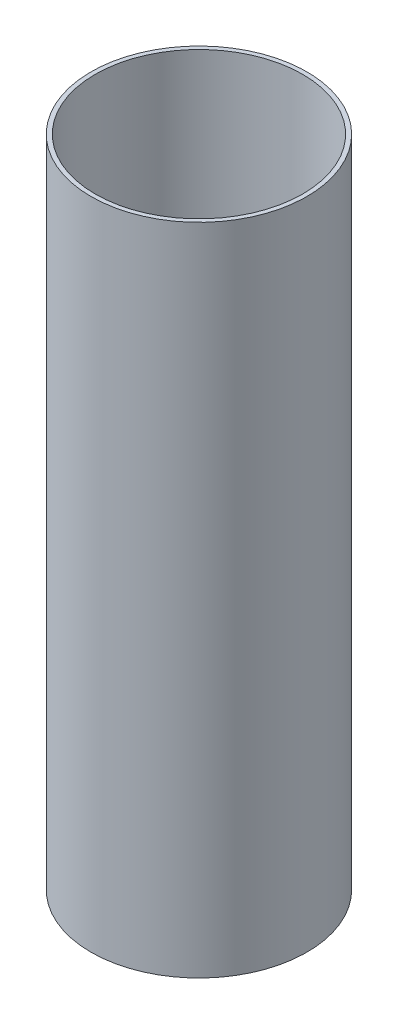
from build123d import *

# Parameters (mm, degrees)
SKETCH1_R           = 37.95
SKETCH1_R_2         = 36.45
BOSS_EXTRUDE1_DEPTH = 230


with BuildPart() as part:
    # Sketch1 → Boss-Extrude1 (new body)
    with BuildSketch(Plane(origin=(0, 0, 0), x_dir=(1, 0, 0), z_dir=(0, 1, 0))):
        with Locations(Location((0, 0, 0), (0, 0, 270))):
            Circle(SKETCH1_R)
        with Locations(Location((0, 0, 0), (0, 0, 270))):
            Circle(SKETCH1_R_2, mode=Mode.SUBTRACT)
    extrude(amount=BOSS_EXTRUDE1_DEPTH)


solid = part.part
